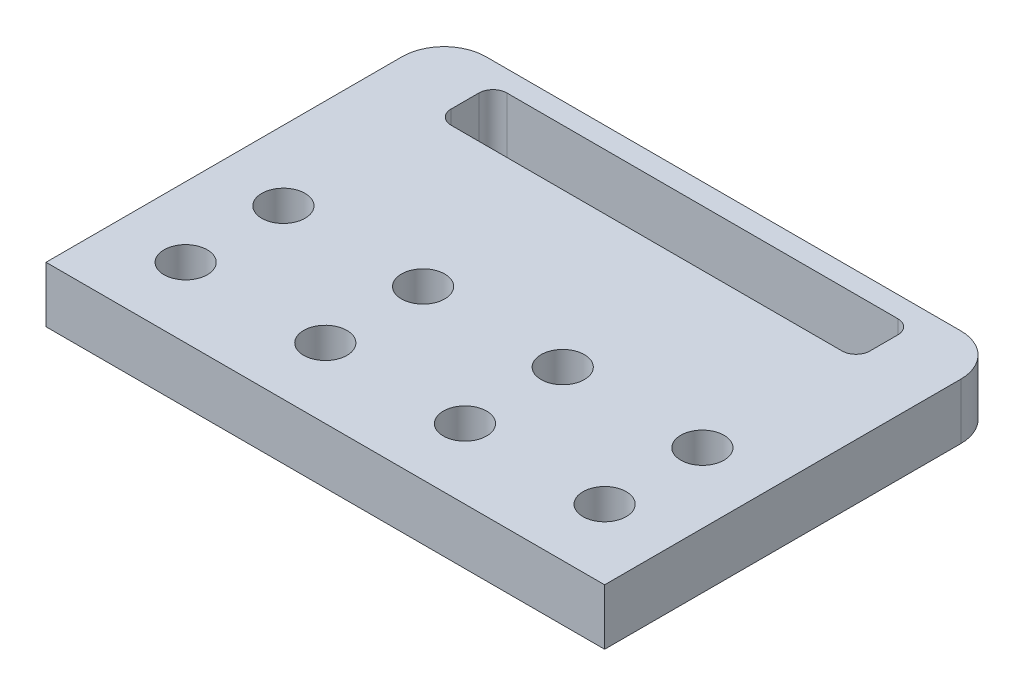
from build123d import *

# Parameters (mm, degrees)
SKETCH_1_W          = 40
SKETCH_1_H          = 28.5
EXTRUDE_1_DEPTH     = 4
SKETCH_2_R          = 1.55
CUT_EXTRUDE_1_DEPTH = 25.880966621
SKETCH_3_R          = 1.55
CUT_EXTRUDE_2_DEPTH = 25.880966621
FILLET_1_R          = 3


with BuildPart() as part:
    # 草图1 → 凸台-拉伸1 (new body)
    with BuildSketch(Plane(origin=(0, 0, 0), x_dir=(1, 0, 0), z_dir=(0, 1, 0))):
        Rectangle(SKETCH_1_W, SKETCH_1_H)
        with BuildLine():
            Line((-14, 12.75), (14, 12.75))
            ThreePointArc((14, 12.75), (14.707106781, 12.457106781), (15, 11.75))
            Line((15, 11.75), (15, 9.75))
            ThreePointArc((15, 9.75), (14.707106781, 9.042893219), (14, 8.75))
            Line((14, 8.75), (-14, 8.75))
            ThreePointArc((-14, 8.75), (-14.707106781, 9.042893219), (-15, 9.75))
            Line((-15, 9.75), (-15, 11.75))
            ThreePointArc((-15, 11.75), (-14.707106781, 12.457106781), (-14, 12.75))
        make_face(mode=Mode.SUBTRACT)
    extrude(amount=EXTRUDE_1_DEPTH)

    # 草图2 → 切除-拉伸1 (cut, through all)
    with BuildSketch(Plane(origin=(0, 4, 0), x_dir=(1, 0, 0), z_dir=(0, 1, 0))):
        with Locations(Location((-15, -9.25, 0), (0, 0, 270))):
            Circle(SKETCH_2_R)
        with Locations(Location((5, -9.25, 0), (0, 0, 270))):
            Circle(SKETCH_2_R)
        with Locations(Location((15, -9.25, 0), (0, 0, 90))):
            Circle(SKETCH_2_R)
        with Locations(Location((-5, -9.25, 0), (0, 0, 90))):
            Circle(SKETCH_2_R)
    extrude(amount=-CUT_EXTRUDE_1_DEPTH, mode=Mode.SUBTRACT)

    # 草图3 → 切除-拉伸2 (cut, through all)
    with BuildSketch(Plane(origin=(0, 4, 0), x_dir=(1, 0, 0), z_dir=(0, 1, 0))):
        with Locations(Location((-15, -2.25, 0), (0, 0, 270))):
            Circle(SKETCH_3_R)
        with Locations(Location((-5, -2.25, 0), (0, 0, 270))):
            Circle(SKETCH_3_R)
        with Locations(Location((5, -2.25, 0), (0, 0, 270))):
            Circle(SKETCH_3_R)
        with Locations(Location((15, -2.25, 0), (0, 0, 270))):
            Circle(SKETCH_3_R)
    extrude(amount=-CUT_EXTRUDE_2_DEPTH, mode=Mode.SUBTRACT)

    # 圆角1
    fillet_1_edges = [part.edges().sort_by_distance(p)[0] for p in [
        (-20, 2, -14.25),
        (20, 2, -14.25),
    ]]
    fillet(fillet_1_edges, radius=FILLET_1_R)


solid = part.part
